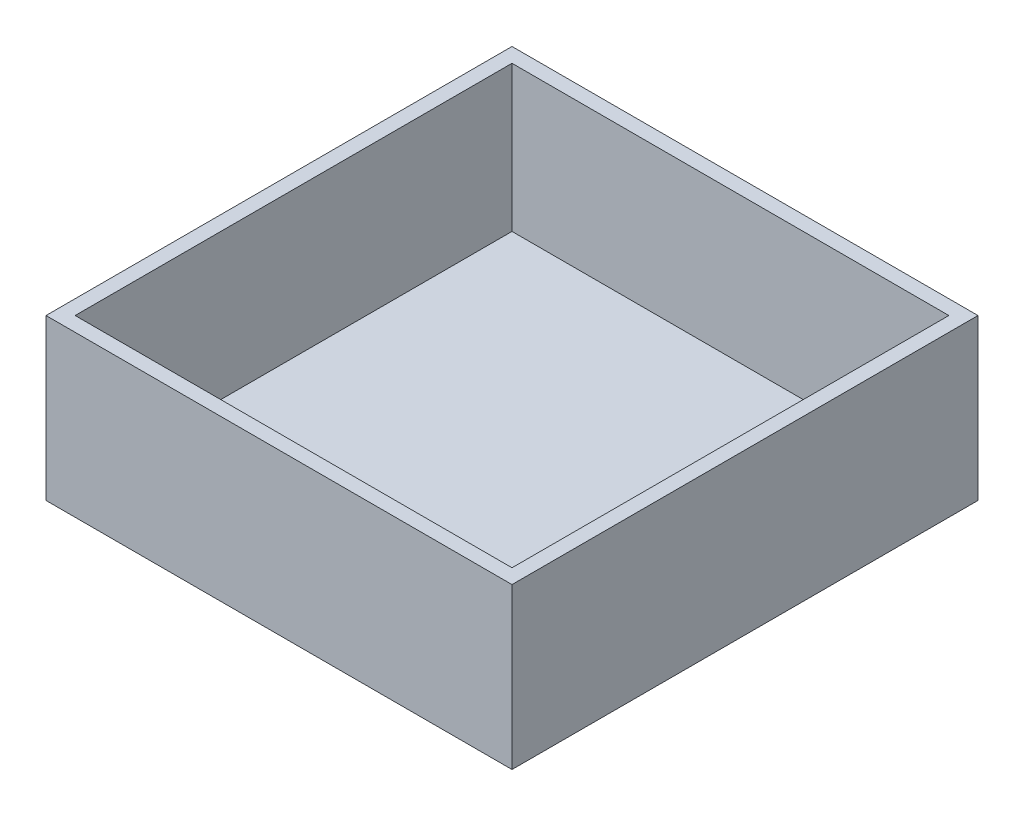
from build123d import *

# Parameters (mm, degrees)
ESQUISSE1_W        = 150
ESQUISSE1_H        = 150
BOSS_EXTRU_1_DEPTH = 50
COQUE2_T           = 5


with BuildPart() as part:
    # Esquisse1 → Boss.-Extru.1 (new body)
    with BuildSketch(Plane(origin=(0, 0, 0), x_dir=(1, 0, 0), z_dir=(0, 1, 0))):
        Rectangle(ESQUISSE1_W, ESQUISSE1_H)
    extrude(amount=BOSS_EXTRU_1_DEPTH)

    # Coque2
    coque2_openings = [part.faces().sort_by_distance(p)[0] for p in [
        (0, 50, 0),
    ]]
    offset(amount=COQUE2_T, openings=coque2_openings, kind=Kind.INTERSECTION)


solid = part.part
